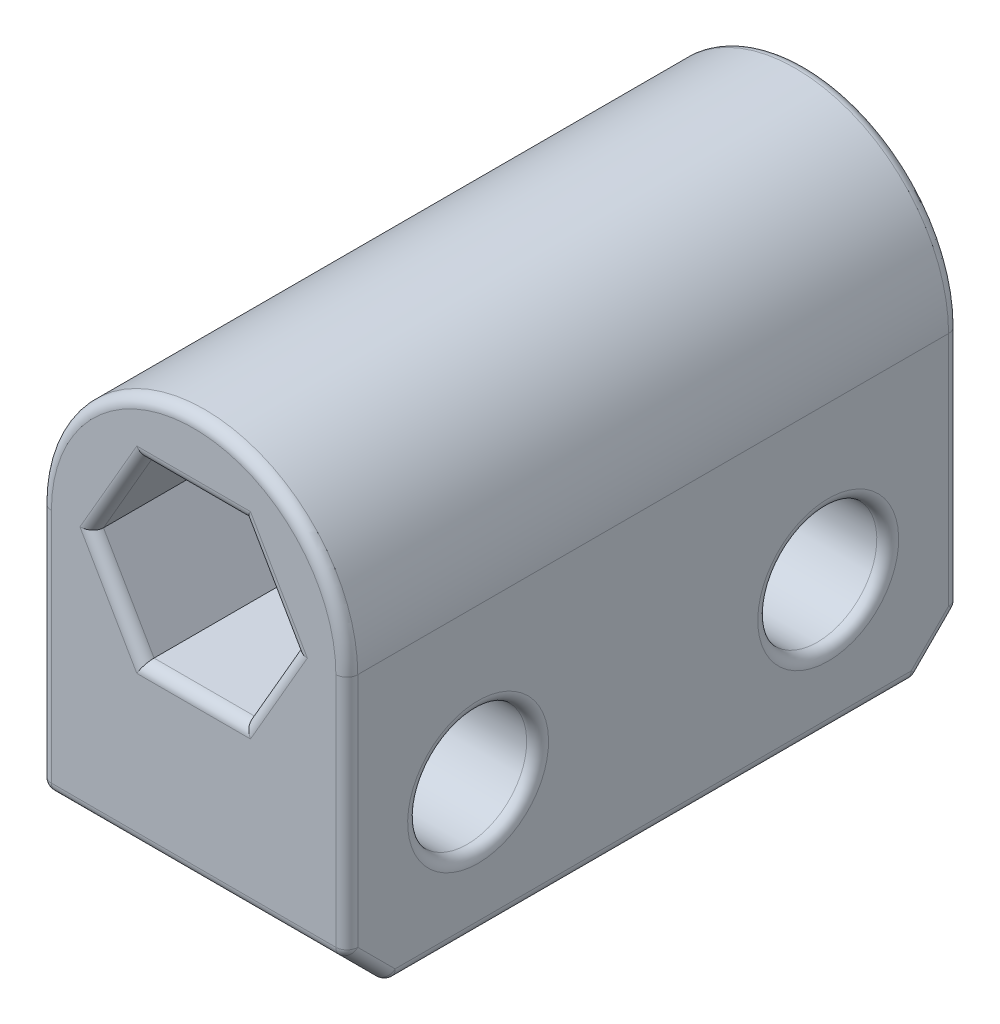
from build123d import *

# Parameters (mm, degrees)
BOSS_EXTRUDE1_DEPTH = 11.1125
SKETCH2_R           = 2.159
CUT_EXTRUDE1_DEPTH  = 19.800316861
CHAMFER2_SIZE       = 1.5875
FILLET2_R           = 0.396875


with BuildPart() as part:
    # Sketch1 → Boss-Extrude1 (new, symmetric)
    with BuildSketch(Plane.XY):
        with BuildLine():
            Line((-5.55625, 0), (-5.55625, -10.31875))
            Line((-5.55625, -10.31875), (5.55625, -10.31875))
            Line((5.55625, -10.31875), (5.55625, 0))
            ThreePointArc((5.55625, 0), (0, 5.55625), (-5.55625, 0))
        make_face()
        Polygon((3.666174209, 0), (1.833087105, 3.175), (-1.833087105, 3.175), (-3.666174209, 0), (-1.833087105, -3.175), (1.833087105, -3.175), align=None, mode=Mode.SUBTRACT)
    extrude(amount=BOSS_EXTRUDE1_DEPTH, both=True)

    # Sketch2 → Cut-Extrude1 (cut, through all)
    with BuildSketch(Plane.ZY.offset(5.55625)):
        with Locations(Location((-6.35, -5.55625, 0), (0, 0, 270))):
            Circle(SKETCH2_R)
        with Locations(Location((6.35, -5.55625, 0), (0, 0, 270))):
            Circle(SKETCH2_R)
    extrude(amount=-CUT_EXTRUDE1_DEPTH, mode=Mode.SUBTRACT)

    # Chamfer2
    chamfer2_edges = [part.edges().sort_by_distance(p)[0] for p in [
        (0, -10.31875, 11.1125),
        (0, -10.31875, -11.1125),
    ]]
    chamfer(chamfer2_edges, length=CHAMFER2_SIZE)

    # Fillet2
    fillet2_edges = [part.edges().sort_by_distance(p)[0] for p in [
        (2.749630657, -1.5875, -11.1125),
        (2.749630657, 1.5875, -11.1125),
        (0, 3.175, -11.1125),
        (-2.749630657, 1.5875, -11.1125),
        (-2.749630657, -1.5875, -11.1125),
        (0, -3.175, -11.1125),
        (2.749630657, -1.5875, 11.1125),
        (2.749630657, 1.5875, 11.1125),
        (0, 3.175, 11.1125),
        (-2.749630657, 1.5875, 11.1125),
        (-2.749630657, -1.5875, 11.1125),
        (0, -3.175, 11.1125),
        (5.55625, -3.39725, -6.35),
        (-5.55625, -3.39725, -6.35),
        (5.55625, -3.39725, 6.35),
        (-5.55625, -3.39725, 6.35),
        (5.55625, -4.365625, 11.1125),
        (0, -8.73125, 11.1125),
        (5.55625, -4.365625, -11.1125),
        (5.55625, -10.31875, 0),
        (5.55625, -9.525, -10.31875),
        (5.55625, -9.525, 10.31875),
        (-5.55625, -10.31875, 0),
        (0, -10.31875, -9.525),
        (0, -10.31875, 9.525),
        (0, 5.55625, 11.1125),
        (-5.55625, -9.525, -10.31875),
        (-5.55625, -9.525, 10.31875),
        (0, -8.73125, -11.1125),
        (-5.55625, -4.365625, -11.1125),
        (0, 5.55625, -11.1125),
        (-5.55625, -4.365625, 11.1125),
    ]]
    fillet(fillet2_edges, radius=FILLET2_R)


solid = part.part
